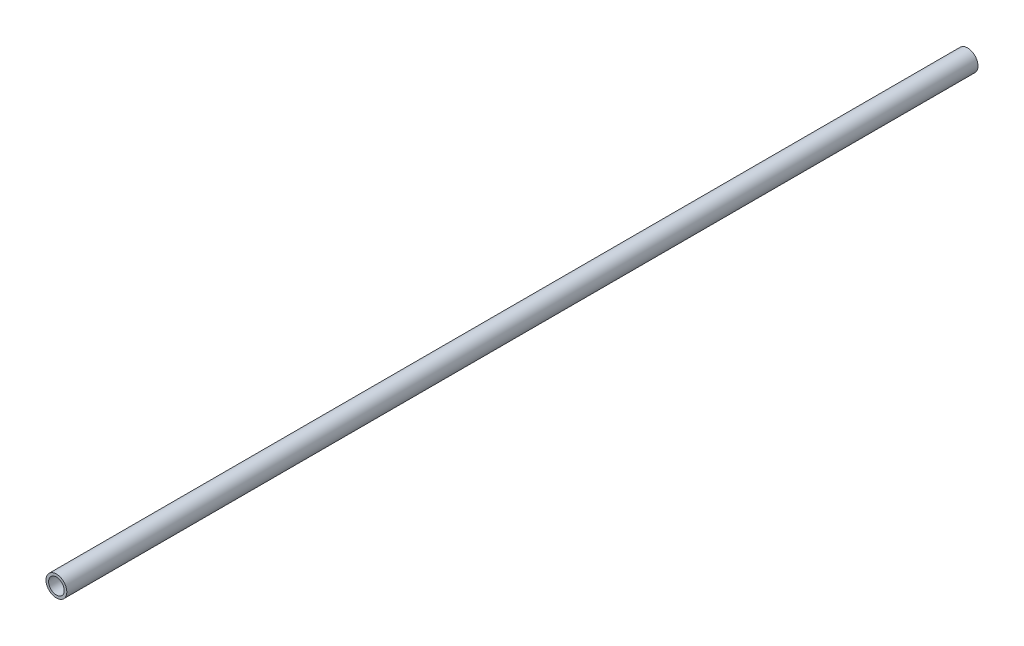
from build123d import *

# Parameters (mm, degrees)
SKETCH1_R           = 4
SKETCH1_R_2         = 3
BOSS_EXTRUDE1_DEPTH = 350


with BuildPart() as part:
    # Sketch1 → Boss-Extrude1 (new body)
    with BuildSketch(Plane.XY):
        Circle(SKETCH1_R)
        Circle(SKETCH1_R_2, mode=Mode.SUBTRACT)
    extrude(amount=BOSS_EXTRUDE1_DEPTH)


solid = part.part
